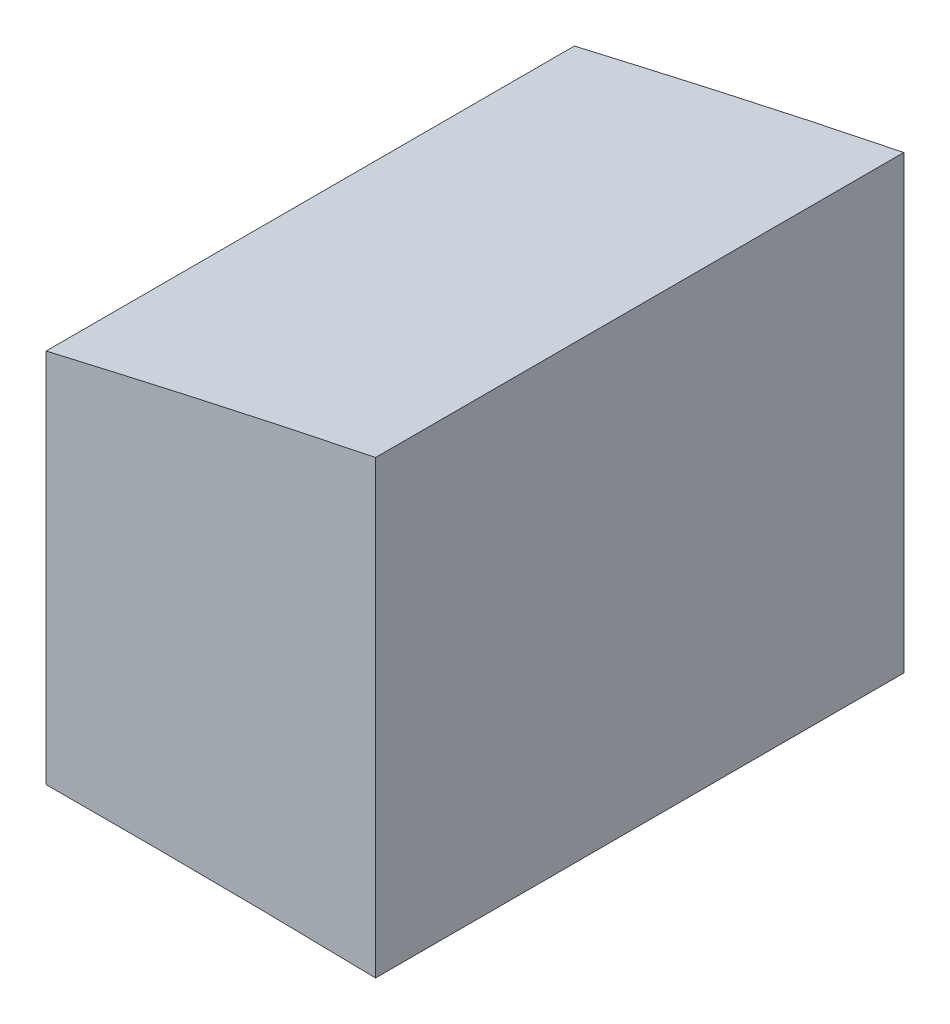
from build123d import *

# Parameters (mm, degrees)
SKETCH1_R           = 2.127
BOSS_EXTRUDE1_DEPTH = 28.956
SKETCH2_W           = 215.463137009
SKETCH2_H           = 53.36276468
CUT_EXTRUDE1_DEPTH  = 28.956


with BuildPart() as part:
    # Sketch1 → Boss-Extrude1 (new body)
    with BuildSketch(Plane.XY):
        with BuildLine():
            Line((-66.006971629, 14.952323969), (-66.006971629, -5.634708623))
            add(Edge.make_bspline(
                [(-66.006971629, -5.634708623), (-44.594037188, -5.53917688), (-13.013022308, -6.724098502), (26.136656569, -12.750856754), (48.765267423, -16.900764204), (64.683362663, -16.969052393), (75.290630493, -17.522529218), (76.216996263, -12.308293591)],
                knots=[0.133250972, 0.133250972, 0.133250972, 0.133250972, 0.517329722, 0.696666541, 0.849409938, 0.919519723, 1, 1, 1, 1], degree=3))
            add(Edge.make_bspline(
                [(76.216996263, -12.308293591), (75.606952539, -6.766559658), (69.704300689, 1.138389205), (56.422236631, 10.264383598), (36.976103105, 19.370772836), (8.741687209, 24.815403957), (-27.455234983, 23.566672909), (-52.387628688, 18.103631651), (-66.006971629, 14.952323969)],
                knots=[0, 0, 0, 0, 0.086586993, 0.161737428, 0.268322265, 0.445156627, 0.638028873, 0.872370876, 0.872370876, 0.872370876, 0.872370876], degree=3))
        make_face()
        with Locations((63.516996263, -7.228293591)):
            Circle(SKETCH1_R, mode=Mode.SUBTRACT)
        with Locations((-25.383003737, 13.091706409)):
            Circle(SKETCH1_R, mode=Mode.SUBTRACT)
    extrude(amount=BOSS_EXTRUDE1_DEPTH)

    # Sketch2 → Cut-Extrude1 (cut)
    with BuildSketch(Plane.XY.offset(28.956)):
        with Locations((59.780513575, 4.011118028)):
            Rectangle(SKETCH2_W, SKETCH2_H)
    extrude(amount=-CUT_EXTRUDE1_DEPTH, mode=Mode.SUBTRACT)


solid = part.part
